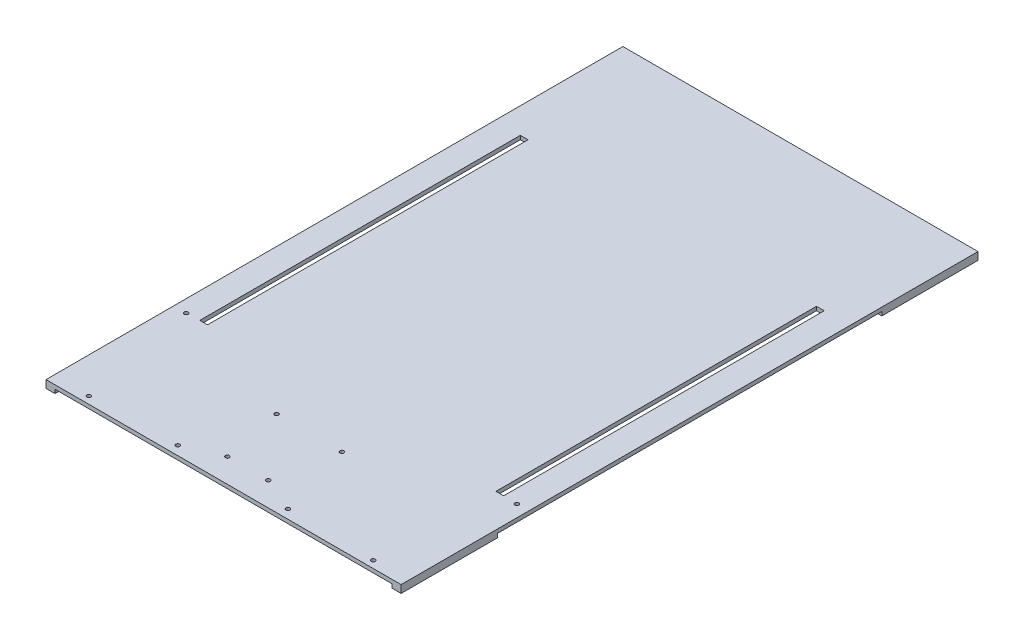
from build123d import *

# Parameters (mm, degrees)
SKETCH1_W           = 277
SKETCH1_H           = 3
BOSS_EXTRUDE1_DEPTH = 450
CUT_EXTRUDE1_REACH  = 520.295
SKETCH2_W           = 6
SKETCH2_H           = 250
CUT_EXTRUDE2_REACH  = 520.295
SKETCH3_R           = 1.55
SKETCH4_W           = 7
SKETCH4_H           = 75
SKETCH4_W_2         = 5
SKETCH4_H_2         = 35
BOSS_EXTRUDE2_DEPTH = 3


with BuildPart() as part:
    # Sketch1 → Boss-Extrude1 (new body)
    with BuildSketch(Plane.XY):
        with Locations((-118.640040599, -13.427850278)):
            Rectangle(SKETCH1_W, SKETCH1_H)
    extrude(amount=BOSS_EXTRUDE1_DEPTH)

    # Sketch2 → Cut-Extrude1 (cut, up to next)
    with BuildSketch(Plane(origin=(0, -11.927850278, 0), x_dir=(1, 0, 0), z_dir=(0, 1, 0)), mode=Mode.PRIVATE) as cut_extrude1_sk1:
        with Locations((-234.140040599, -225)):
            Rectangle(SKETCH2_W, SKETCH2_H)
    cut_extrude1_tool1 = extrude(cut_extrude1_sk1.sketch, amount=-CUT_EXTRUDE1_REACH, mode=Mode.PRIVATE) & part.part
    # Sketch2 → Cut-Extrude1 (cut, up to next)
    with BuildSketch(Plane(origin=(0, -11.927850278, 0), x_dir=(1, 0, 0), z_dir=(0, 1, 0)), mode=Mode.PRIVATE) as cut_extrude1_sk2:
        with Locations((-3.140040599, -225)):
            Rectangle(SKETCH2_W, SKETCH2_H)
    cut_extrude1_tool2 = extrude(cut_extrude1_sk2.sketch, amount=-CUT_EXTRUDE1_REACH, mode=Mode.PRIVATE) & part.part
    add(cut_extrude1_tool1.solids().sort_by_distance((-234.140041, -11.92785, 225))[0], mode=Mode.SUBTRACT)
    add(cut_extrude1_tool2.solids().sort_by_distance((-3.140041, -11.92785, 225))[0], mode=Mode.SUBTRACT)

    # Sketch3 → Cut-Extrude2 (cut, up to next)
    with BuildSketch(Plane(origin=(0, -11.927850278, 0), x_dir=(1, 0, 0), z_dir=(0, 1, 0)), mode=Mode.PRIVATE) as cut_extrude2_sk1:
        with Locations(Location((-102.460040599, -431.322984009, 0), (0, 0, 180))):
            Circle(SKETCH3_R)
    cut_extrude2_tool1 = extrude(cut_extrude2_sk1.sketch, amount=-CUT_EXTRUDE2_REACH, mode=Mode.PRIVATE) & part.part
    # Sketch3 → Cut-Extrude2 (cut, up to next)
    with BuildSketch(Plane(origin=(0, -11.927850278, 0), x_dir=(1, 0, 0), z_dir=(0, 1, 0)), mode=Mode.PRIVATE) as cut_extrude2_sk2:
        with Locations(Location((-75.460040599, -442.983238046, 0), (0, 0, 180))):
            Circle(SKETCH3_R)
    cut_extrude2_tool2 = extrude(cut_extrude2_sk2.sketch, amount=-CUT_EXTRUDE2_REACH, mode=Mode.PRIVATE) & part.part
    # Sketch3 → Cut-Extrude2 (cut, up to next)
    with BuildSketch(Plane(origin=(0, -11.927850278, 0), x_dir=(1, 0, 0), z_dir=(0, 1, 0)), mode=Mode.PRIVATE) as cut_extrude2_sk3:
        with Locations(Location((-92.910040599, -383.404829271, 0), (0, 0, 180))):
            Circle(SKETCH3_R)
    cut_extrude2_tool3 = extrude(cut_extrude2_sk3.sketch, amount=-CUT_EXTRUDE2_REACH, mode=Mode.PRIVATE) & part.part
    # Sketch3 → Cut-Extrude2 (cut, up to next)
    with BuildSketch(Plane(origin=(0, -11.927850278, 0), x_dir=(1, 0, 0), z_dir=(0, 1, 0)), mode=Mode.PRIVATE) as cut_extrude2_sk4:
        with Locations(Location((10.539959401, -350.404829271, 0), (0, 0, 180))):
            Circle(SKETCH3_R)
    cut_extrude2_tool4 = extrude(cut_extrude2_sk4.sketch, amount=-CUT_EXTRUDE2_REACH, mode=Mode.PRIVATE) & part.part
    # Sketch3 → Cut-Extrude2 (cut, up to next)
    with BuildSketch(Plane(origin=(0, -11.927850278, 0), x_dir=(1, 0, 0), z_dir=(0, 1, 0)), mode=Mode.PRIVATE) as cut_extrude2_sk5:
        with Locations(Location((-7.460040599, -444.433238046, 0), (0, 0, 180))):
            Circle(SKETCH3_R)
    cut_extrude2_tool5 = extrude(cut_extrude2_sk5.sketch, amount=-CUT_EXTRUDE2_REACH, mode=Mode.PRIVATE) & part.part
    # Sketch3 → Cut-Extrude2 (cut, up to next)
    with BuildSketch(Plane(origin=(0, -11.927850278, 0), x_dir=(1, 0, 0), z_dir=(0, 1, 0)), mode=Mode.PRIVATE) as cut_extrude2_sk6:
        with Locations(Location((-247.340040599, -350.40562763, 0), (0, 0, 180))):
            Circle(SKETCH3_R)
    cut_extrude2_tool6 = extrude(cut_extrude2_sk6.sketch, amount=-CUT_EXTRUDE2_REACH, mode=Mode.PRIVATE) & part.part
    # Sketch3 → Cut-Extrude2 (cut, up to next)
    with BuildSketch(Plane(origin=(0, -11.927850278, 0), x_dir=(1, 0, 0), z_dir=(0, 1, 0)), mode=Mode.PRIVATE) as cut_extrude2_sk7:
        with Locations(Location((-229.340040599, -444.434036405, 0), (0, 0, 180))):
            Circle(SKETCH3_R)
    cut_extrude2_tool7 = extrude(cut_extrude2_sk7.sketch, amount=-CUT_EXTRUDE2_REACH, mode=Mode.PRIVATE) & part.part
    # Sketch3 → Cut-Extrude2 (cut, up to next)
    with BuildSketch(Plane(origin=(0, -11.927850278, 0), x_dir=(1, 0, 0), z_dir=(0, 1, 0)), mode=Mode.PRIVATE) as cut_extrude2_sk8:
        with Locations(Location((-161.340040599, -442.984036405, 0), (0, 0, 180))):
            Circle(SKETCH3_R)
    cut_extrude2_tool8 = extrude(cut_extrude2_sk8.sketch, amount=-CUT_EXTRUDE2_REACH, mode=Mode.PRIVATE) & part.part
    # Sketch3 → Cut-Extrude2 (cut, up to next)
    with BuildSketch(Plane(origin=(0, -11.927850278, 0), x_dir=(1, 0, 0), z_dir=(0, 1, 0)), mode=Mode.PRIVATE) as cut_extrude2_sk9:
        with Locations(Location((-134.340040599, -431.323782367, 0), (0, 0, 180))):
            Circle(SKETCH3_R)
    cut_extrude2_tool9 = extrude(cut_extrude2_sk9.sketch, amount=-CUT_EXTRUDE2_REACH, mode=Mode.PRIVATE) & part.part
    # Sketch3 → Cut-Extrude2 (cut, up to next)
    with BuildSketch(Plane(origin=(0, -11.927850278, 0), x_dir=(1, 0, 0), z_dir=(0, 1, 0)), mode=Mode.PRIVATE) as cut_extrude2_sk10:
        with Locations(Location((-143.890040599, -383.40562763, 0), (0, 0, 180))):
            Circle(SKETCH3_R)
    cut_extrude2_tool10 = extrude(cut_extrude2_sk10.sketch, amount=-CUT_EXTRUDE2_REACH, mode=Mode.PRIVATE) & part.part
    add(cut_extrude2_tool1.solids().sort_by_distance((-102.460041, -11.92785, 431.322984))[0], mode=Mode.SUBTRACT)
    add(cut_extrude2_tool2.solids().sort_by_distance((-75.460041, -11.92785, 442.983238))[0], mode=Mode.SUBTRACT)
    add(cut_extrude2_tool3.solids().sort_by_distance((-92.910041, -11.92785, 383.404829))[0], mode=Mode.SUBTRACT)
    add(cut_extrude2_tool4.solids().sort_by_distance((10.539959, -11.92785, 350.404829))[0], mode=Mode.SUBTRACT)
    add(cut_extrude2_tool5.solids().sort_by_distance((-7.460041, -11.92785, 444.433238))[0], mode=Mode.SUBTRACT)
    add(cut_extrude2_tool6.solids().sort_by_distance((-247.340041, -11.92785, 350.405628))[0], mode=Mode.SUBTRACT)
    add(cut_extrude2_tool7.solids().sort_by_distance((-229.340041, -11.92785, 444.434036))[0], mode=Mode.SUBTRACT)
    add(cut_extrude2_tool8.solids().sort_by_distance((-161.340041, -11.92785, 442.984036))[0], mode=Mode.SUBTRACT)
    add(cut_extrude2_tool9.solids().sort_by_distance((-134.340041, -11.92785, 431.323782))[0], mode=Mode.SUBTRACT)
    add(cut_extrude2_tool10.solids().sort_by_distance((-143.890041, -11.92785, 383.405628))[0], mode=Mode.SUBTRACT)

    # Sketch4 → Boss-Extrude2 (add)
    with BuildSketch(Plane.XZ.offset(14.927850278)):
        with Locations((-253.640040599, 412.5)):
            Rectangle(SKETCH4_W, SKETCH4_H)
        with Locations((16.359959401, 412.5)):
            Rectangle(SKETCH4_W, SKETCH4_H)
        with Locations((-253.640040599, 37.5)):
            Rectangle(SKETCH4_W, SKETCH4_H)
        with Locations((16.359959401, 37.5)):
            Rectangle(SKETCH4_W, SKETCH4_H)
        with Locations((-118.640040599, 217.477852068)):
            Rectangle(SKETCH4_W_2, SKETCH4_H_2)
    extrude(amount=BOSS_EXTRUDE2_DEPTH)


solid = part.part
